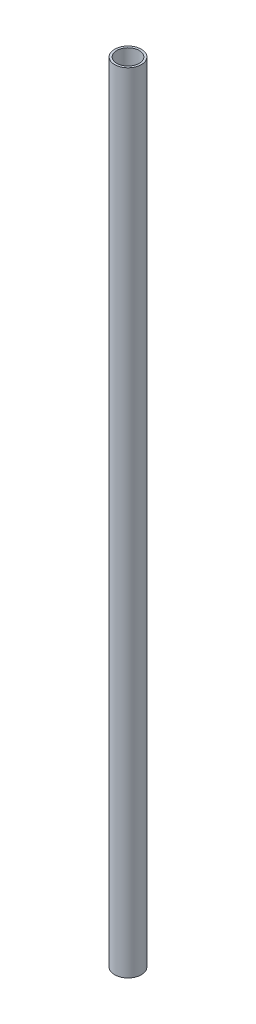
from build123d import *

# Parameters (mm, degrees)
SKETCH1_R           = 12.500000019
SKETCH1_R_2         = 10.499999955
BOSS_EXTRUDE1_DEPTH = 738


with BuildPart() as part:
    # Sketch1 → Boss-Extrude1 (new body)
    with BuildSketch(Plane(origin=(0, 0, 0), x_dir=(1, 0, 0), z_dir=(0, 1, 0))):
        with Locations(Location((0, 0, 0), (0, 0, 270))):
            Circle(SKETCH1_R)
        with Locations(Location((0, 0, 0), (0, 0, 270))):
            Circle(SKETCH1_R_2, mode=Mode.SUBTRACT)
    extrude(amount=BOSS_EXTRUDE1_DEPTH)


solid = part.part
